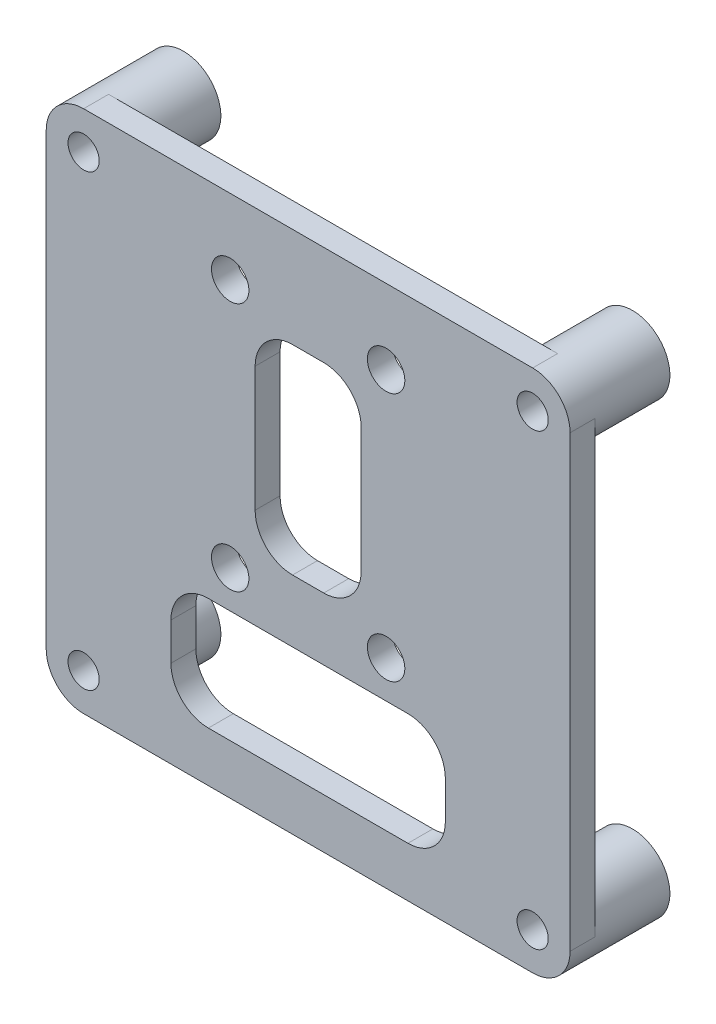
from build123d import *

# Parameters (mm, degrees)
SKETCH_1_W          = 42
SKETCH_1_H          = 42
EXTRUDE_1_DEPTH     = 2
SKETCH_2_R          = 1.5
SKETCH_2_R_2        = 1.25
SKETCH_2_W          = 8.5
SKETCH_2_H          = 16
SKETCH_2_W_2        = 22
SKETCH_2_H_2        = 9
CUT_EXTRUDE_1_DEPTH = 2
FILLET_1_R          = 3
SKETCH_3_R          = 3
SKETCH_3_R_2        = 1.25
SKETCH_3_R_3        = 1.234283691
SKETCH_3_R_4        = 1.239522306
EXTRUDE_2_DEPTH     = 6


with BuildPart() as part:
    # 草图1 → 凸台-拉伸1 (new body)
    with BuildSketch(Plane.XY):
        Rectangle(SKETCH_1_W, SKETCH_1_H)
    extrude(amount=EXTRUDE_1_DEPTH)

    # 草图2 → 切除-拉伸1 (cut)
    with BuildSketch(Plane(origin=(0, 0, 0), x_dir=(-1, 0, 0), z_dir=(0, 0, -1))):
        with Locations((-6.25, 15)):
            Circle(SKETCH_2_R)
        with Locations((6.25, 15)):
            Circle(SKETCH_2_R)
        with Locations((6.25, -5)):
            Circle(SKETCH_2_R)
        with Locations((-6.25, -5)):
            Circle(SKETCH_2_R)
        with Locations((18, -18)):
            Circle(SKETCH_2_R_2)
        with Locations((-18, -18)):
            Circle(SKETCH_2_R_2)
        with Locations((-18, 18)):
            Circle(SKETCH_2_R_2)
        with Locations((18, 18)):
            Circle(SKETCH_2_R_2)
        with Locations((0, 5)):
            Rectangle(SKETCH_2_W, SKETCH_2_H)
        with Locations((0, -12.5)):
            Rectangle(SKETCH_2_W_2, SKETCH_2_H_2)
    extrude(amount=-CUT_EXTRUDE_1_DEPTH, mode=Mode.SUBTRACT)

    # 圆角1
    fillet_1_edges = [part.edges().sort_by_distance(p)[0] for p in [
        (-11, -8, 1),
        (-11, -17, 1),
        (11, -17, 1),
        (11, -8, 1),
        (4.25, 13, 1),
        (-4.25, 13, 1),
        (-4.25, -3, 1),
        (4.25, -3, 1),
        (21, -21, 1),
        (-21, -21, 1),
        (-21, 21, 1),
        (21, 21, 1),
    ]]
    fillet(fillet_1_edges, radius=FILLET_1_R)

    # 草图3 → 凸台-拉伸2 (add)
    # profile 1 of 4: a face of its own
    with BuildSketch(Plane(origin=(0, 0, 0), x_dir=(-1, 0, 0), z_dir=(0, 0, -1))):
        with Locations((18, 18)):
            Circle(SKETCH_3_R)
        with Locations((18, 18)):
            Circle(SKETCH_3_R_2, mode=Mode.SUBTRACT)
    # profile 2 of 4: a face of its own
    with BuildSketch(Plane(origin=(0, 0, 0), x_dir=(-1, 0, 0), z_dir=(0, 0, -1))):
        with Locations((18, -18)):
            Circle(SKETCH_3_R)
        with Locations((18, -18)):
            Circle(SKETCH_3_R_2, mode=Mode.SUBTRACT)
    # profile 3 of 4: a face of its own
    with BuildSketch(Plane(origin=(0, 0, 0), x_dir=(-1, 0, 0), z_dir=(0, 0, -1))):
        with Locations((-18, -18)):
            Circle(SKETCH_3_R)
        with Locations((-18, -18)):
            Circle(SKETCH_3_R_3, mode=Mode.SUBTRACT)
    # profile 4 of 4: a face of its own
    with BuildSketch(Plane(origin=(0, 0, 0), x_dir=(-1, 0, 0), z_dir=(0, 0, -1))):
        with Locations((-18, 18)):
            Circle(SKETCH_3_R)
        with Locations((-18, 18)):
            Circle(SKETCH_3_R_4, mode=Mode.SUBTRACT)
    extrude(amount=EXTRUDE_2_DEPTH)


solid = part.part
